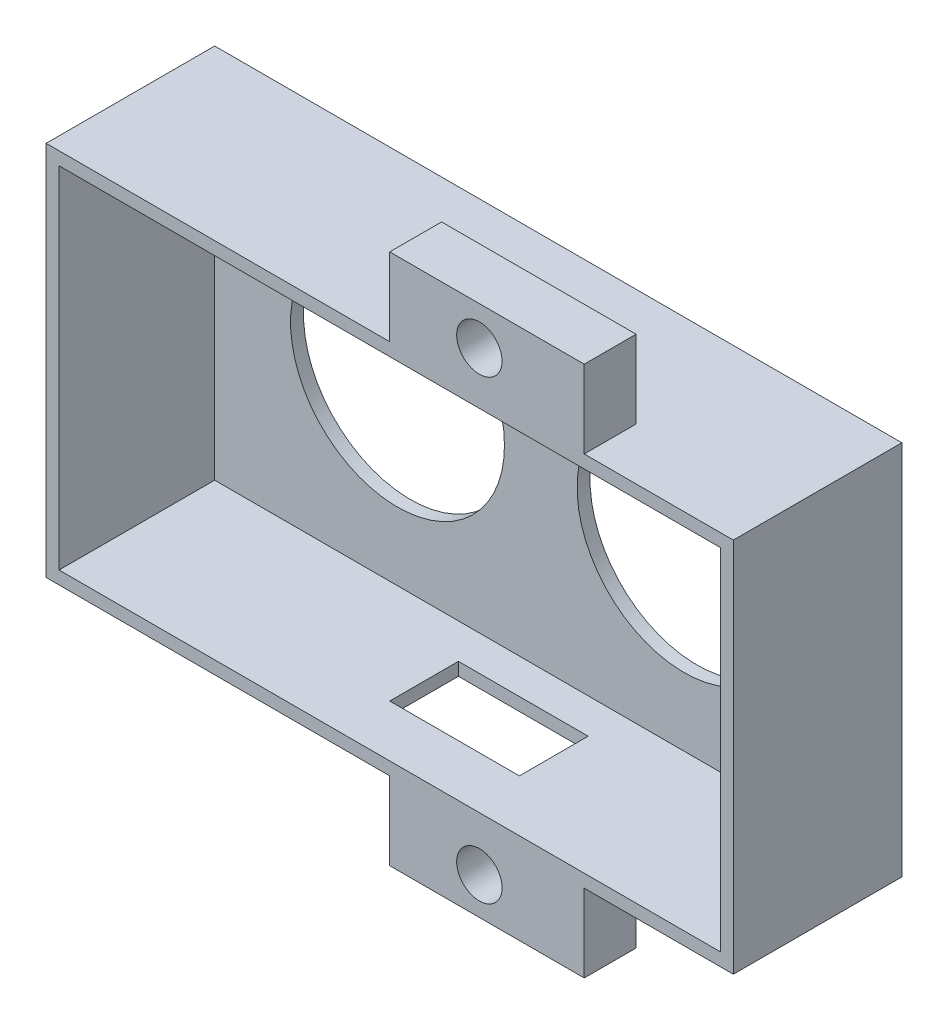
from build123d import *

# Parameters (mm, degrees)
SKETCH1_W           = 53
SKETCH1_H           = 29
BOSS_EXTRUDE2_DEPTH = 13
SHELL5_T            = -1
SKETCH3_R           = 8.25
CUT_EXTRUDE1_DEPTH  = 13
SKETCH4_W           = 10
SKETCH4_H           = 5.3
CUT_EXTRUDE2_DEPTH  = 13
SKETCH5_W           = 15
SKETCH5_H           = 6
BOSS_EXTRUDE3_DEPTH = 4
SKETCH6_R           = 1.75
CUT_EXTRUDE3_DEPTH  = 6


with BuildPart() as part:
    # Sketch1 → Boss-Extrude2 (new body)
    with BuildSketch(Plane.XY):
        Rectangle(SKETCH1_W, SKETCH1_H)
    extrude(amount=BOSS_EXTRUDE2_DEPTH)

    # Shell5
    shell5_openings = [part.faces().sort_by_distance(p)[0] for p in [
        (0, 0, 13),
    ]]
    offset(amount=SHELL5_T, openings=shell5_openings, kind=Kind.INTERSECTION)

    # Sketch3 → Cut-Extrude1 (cut)
    with BuildSketch(Plane.XY.offset(1)):
        with Locations((-11.4, 0)):
            Circle(SKETCH3_R)
        with Locations((10.7, 0)):
            Circle(SKETCH3_R)
    extrude(amount=-CUT_EXTRUDE1_DEPTH, mode=Mode.SUBTRACT)

    # Sketch4 → Cut-Extrude2 (cut)
    with BuildSketch(Plane.XZ.offset(14.5)):
        with Locations((1, 6.35)):
            Rectangle(SKETCH4_W, SKETCH4_H)
    extrude(amount=-CUT_EXTRUDE2_DEPTH, mode=Mode.SUBTRACT)

    # Sketch5 → Boss-Extrude3 (add)
    with BuildSketch(Plane.XY.offset(13)):
        with Locations((7.5, 17.5)):
            Rectangle(SKETCH5_W, SKETCH5_H)
        with Locations((7.5, -17.5)):
            Rectangle(SKETCH5_W, SKETCH5_H)
    extrude(amount=-BOSS_EXTRUDE3_DEPTH)

    # Sketch6 → Cut-Extrude3 (cut)
    with BuildSketch(Plane.XY.offset(13)):
        with Locations((6.914840987, 17.533686801)):
            Circle(SKETCH6_R)
        with Locations((6.914840987, -17.647083132)):
            Circle(SKETCH6_R)
    extrude(amount=-CUT_EXTRUDE3_DEPTH, mode=Mode.SUBTRACT)


solid = part.part
